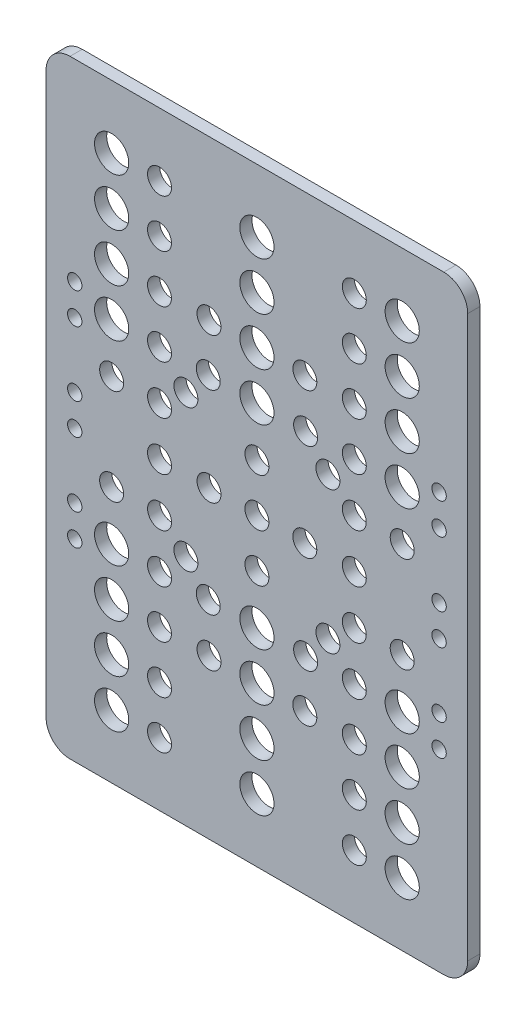
from build123d import *

# Parameters (mm, degrees)
SKETCH2_R           = 3.5685
SKETCH2_R_2         = 2.500000207
SKETCH2_R_3         = 2.500000038
SKETCH2_R_4         = 2.492850486
SKETCH2_R_5         = 1.499992866
SKETCH2_R_6         = 2.500000001
SKETCH2_R_7         = 2.492850485
BOSS_EXTRUDE1_DEPTH = 2.54


with BuildPart() as part:
    # Sketch2 → Boss-Extrude1 (new body)
    with BuildSketch(Plane.XY):
        with BuildLine():
            Line((-92.273812965, -51.714849286), (-14.273812965, -51.714848152))
            ThreePointArc((-14.273812965, -51.714848152), (-10.738279038, -53.179314194), (-9.273812892, -56.714848078))
            Line((-9.273812892, -56.714848078), (-9.273811154, -173.715325349))
            ThreePointArc((-9.273811154, -173.715325349), (-10.738277196, -177.250859277), (-14.273811081, -178.715325423))
            Line((-14.273811081, -178.715325423), (-92.273811081, -178.715326558))
            ThreePointArc((-92.273811081, -178.715326558), (-95.809345008, -177.250860516), (-97.273811154, -173.715326632))
            Line((-97.273811154, -173.715326632), (-97.273812892, -56.714849361))
            ThreePointArc((-97.273812892, -56.714849361), (-95.80934685, -53.179315433), (-92.273812965, -51.714849286))
        make_face()
        with Locations((-83.593812773, -64.894849171)):
            Circle(SKETCH2_R, mode=Mode.SUBTRACT)
        with Locations((-73.598714259, -64.889947536)):
            Circle(SKETCH2_R_2, mode=Mode.SUBTRACT)
        with Locations((-53.273812773, -64.894848719)):
            Circle(SKETCH2_R, mode=Mode.SUBTRACT)
        with Locations((-32.948911283, -64.88994693)):
            Circle(SKETCH2_R_2, mode=Mode.SUBTRACT)
        with Locations((-22.953812773, -64.894848267)):
            Circle(SKETCH2_R, mode=Mode.SUBTRACT)
        with Locations((-83.593812773, -74.894849171)):
            Circle(SKETCH2_R, mode=Mode.SUBTRACT)
        with Locations((-73.598714077, -74.894848647)):
            Circle(SKETCH2_R_3, mode=Mode.SUBTRACT)
        with Locations((-53.273812773, -74.894848719)):
            Circle(SKETCH2_R, mode=Mode.SUBTRACT)
        with Locations((-32.948911213, -74.89484821)):
            Circle(SKETCH2_R_3, mode=Mode.SUBTRACT)
        with Locations((-22.953812773, -74.894848267)):
            Circle(SKETCH2_R, mode=Mode.SUBTRACT)
        with Locations((-22.953812773, -84.894848267)):
            Circle(SKETCH2_R, mode=Mode.SUBTRACT)
        with Locations((-32.948911064, -84.89484821)):
            Circle(SKETCH2_R_3, mode=Mode.SUBTRACT)
        with Locations((-43.273812429, -84.894848364)):
            Circle(SKETCH2_R_3, mode=Mode.SUBTRACT)
        with Locations((-53.273812773, -84.894848719)):
            Circle(SKETCH2_R, mode=Mode.SUBTRACT)
        with Locations((-83.593812773, -84.894849171)):
            Circle(SKETCH2_R, mode=Mode.SUBTRACT)
        with Locations((-73.611151054, -84.902029225)):
            Circle(SKETCH2_R_4, mode=Mode.SUBTRACT)
        with Locations((-63.273812446, -84.894849)):
            Circle(SKETCH2_R_3, mode=Mode.SUBTRACT)
        with Locations((-83.593812773, -94.894849171)):
            Circle(SKETCH2_R, mode=Mode.SUBTRACT)
        with Locations((-73.598713779, -94.894848647)):
            Circle(SKETCH2_R_3, mode=Mode.SUBTRACT)
        with Locations((-63.433812595, -94.89485049)):
            Circle(SKETCH2_R_3, mode=Mode.SUBTRACT)
        with Locations((-53.273812773, -94.894848719)):
            Circle(SKETCH2_R, mode=Mode.SUBTRACT)
        with Locations((-68.09381174, -100.389947487)):
            Circle(SKETCH2_R_2, mode=Mode.SUBTRACT)
        with Locations((-91.293819406, -91.965099732)):
            Circle(SKETCH2_R_5, mode=Mode.SUBTRACT)
        with Locations((-91.293819406, -98.465072086)):
            Circle(SKETCH2_R_5, mode=Mode.SUBTRACT)
        with Locations((-91.293819108, -111.965103757)):
            Circle(SKETCH2_R_5, mode=Mode.SUBTRACT)
        with Locations((-83.593812304, -105.214849125)):
            Circle(SKETCH2_R_3, mode=Mode.SUBTRACT)
        with Locations((-73.593812423, -105.050424838)):
            Circle(SKETCH2_R_3, mode=Mode.SUBTRACT)
        with Locations((-73.598713476, -115.214848518)):
            Circle(SKETCH2_R_3, mode=Mode.SUBTRACT)
        with Locations((-63.273811994, -115.214848871)):
            Circle(SKETCH2_R_3, mode=Mode.SUBTRACT)
        with Locations((-53.273812023, -115.214848719)):
            Circle(SKETCH2_R_6, mode=Mode.SUBTRACT)
        with Locations((-53.273812447, -105.214848674)):
            Circle(SKETCH2_R_3, mode=Mode.SUBTRACT)
        with Locations((-15.253806438, -111.965103757)):
            Circle(SKETCH2_R_5, mode=Mode.SUBTRACT)
        with Locations((-15.25380614, -91.965099732)):
            Circle(SKETCH2_R_5, mode=Mode.SUBTRACT)
        with Locations((-15.25380614, -98.465072086)):
            Circle(SKETCH2_R_5, mode=Mode.SUBTRACT)
        with Locations((-22.953812773, -94.894849171)):
            Circle(SKETCH2_R, mode=Mode.SUBTRACT)
        with Locations((-22.953813242, -105.214849125)):
            Circle(SKETCH2_R_3, mode=Mode.SUBTRACT)
        with Locations((-32.948911767, -94.894848647)):
            Circle(SKETCH2_R_3, mode=Mode.SUBTRACT)
        with Locations((-32.953813123, -105.050424838)):
            Circle(SKETCH2_R_3, mode=Mode.SUBTRACT)
        with Locations((-38.453813806, -100.389947487)):
            Circle(SKETCH2_R_2, mode=Mode.SUBTRACT)
        with Locations((-43.113812951, -94.89485049)):
            Circle(SKETCH2_R_3, mode=Mode.SUBTRACT)
        with Locations((-43.273811978, -115.214848235)):
            Circle(SKETCH2_R_3, mode=Mode.SUBTRACT)
        with Locations((-32.948910612, -115.214848081)):
            Circle(SKETCH2_R_3, mode=Mode.SUBTRACT)
        with Locations((-15.25380614, -138.464597304)):
            Circle(SKETCH2_R_5, mode=Mode.SUBTRACT)
        with Locations((-15.25380614, -131.96462495)):
            Circle(SKETCH2_R_5, mode=Mode.SUBTRACT)
        with Locations((-15.253806438, -118.464593279)):
            Circle(SKETCH2_R_5, mode=Mode.SUBTRACT)
        with Locations((-22.953813242, -125.214847911)):
            Circle(SKETCH2_R_3, mode=Mode.SUBTRACT)
        with Locations((-22.953812773, -135.534847865)):
            Circle(SKETCH2_R, mode=Mode.SUBTRACT)
        with Locations((-22.953812773, -145.534848769)):
            Circle(SKETCH2_R, mode=Mode.SUBTRACT)
        with Locations((-22.953812773, -155.534848769)):
            Circle(SKETCH2_R, mode=Mode.SUBTRACT)
        with Locations((-22.953812773, -165.534848769)):
            Circle(SKETCH2_R, mode=Mode.SUBTRACT)
        with Locations((-32.948911283, -165.539750106)):
            Circle(SKETCH2_R_2, mode=Mode.SUBTRACT)
        with Locations((-32.948911213, -155.534848826)):
            Circle(SKETCH2_R_3, mode=Mode.SUBTRACT)
        with Locations((-32.948911064, -145.534848826)):
            Circle(SKETCH2_R_3, mode=Mode.SUBTRACT)
        with Locations((-32.948911767, -135.534848389)):
            Circle(SKETCH2_R_3, mode=Mode.SUBTRACT)
        with Locations((-38.453813806, -130.039749549)):
            Circle(SKETCH2_R_2, mode=Mode.SUBTRACT)
        with Locations((-32.953813123, -125.379272198)):
            Circle(SKETCH2_R_3, mode=Mode.SUBTRACT)
        with Locations((-43.113812951, -135.534846546)):
            Circle(SKETCH2_R_3, mode=Mode.SUBTRACT)
        with Locations((-43.273812429, -145.534848672)):
            Circle(SKETCH2_R_3, mode=Mode.SUBTRACT)
        with Locations((-53.273812773, -165.534848317)):
            Circle(SKETCH2_R, mode=Mode.SUBTRACT)
        with Locations((-53.273812773, -155.534848317)):
            Circle(SKETCH2_R, mode=Mode.SUBTRACT)
        with Locations((-53.273812773, -145.534848317)):
            Circle(SKETCH2_R, mode=Mode.SUBTRACT)
        with Locations((-53.273812773, -135.534848317)):
            Circle(SKETCH2_R, mode=Mode.SUBTRACT)
        with Locations((-53.273812447, -125.214848362)):
            Circle(SKETCH2_R_3, mode=Mode.SUBTRACT)
        with Locations((-63.273812446, -145.534848036)):
            Circle(SKETCH2_R_3, mode=Mode.SUBTRACT)
        with Locations((-63.433812595, -135.534846546)):
            Circle(SKETCH2_R_3, mode=Mode.SUBTRACT)
        with Locations((-68.09381174, -130.039749549)):
            Circle(SKETCH2_R_2, mode=Mode.SUBTRACT)
        with Locations((-73.593812423, -125.379272198)):
            Circle(SKETCH2_R_3, mode=Mode.SUBTRACT)
        with Locations((-73.598713779, -135.534848389)):
            Circle(SKETCH2_R_3, mode=Mode.SUBTRACT)
        with Locations((-73.611151054, -145.527667811)):
            Circle(SKETCH2_R_7, mode=Mode.SUBTRACT)
        with Locations((-73.598714077, -155.534848389)):
            Circle(SKETCH2_R_3, mode=Mode.SUBTRACT)
        with Locations((-73.598714259, -165.5397495)):
            Circle(SKETCH2_R_2, mode=Mode.SUBTRACT)
        with Locations((-91.293819406, -138.464597304)):
            Circle(SKETCH2_R_5, mode=Mode.SUBTRACT)
        with Locations((-91.293819406, -131.96462495)):
            Circle(SKETCH2_R_5, mode=Mode.SUBTRACT)
        with Locations((-91.293819108, -118.464593279)):
            Circle(SKETCH2_R_5, mode=Mode.SUBTRACT)
        with Locations((-83.593812304, -125.214847911)):
            Circle(SKETCH2_R_3, mode=Mode.SUBTRACT)
        with Locations((-83.593812773, -135.534847865)):
            Circle(SKETCH2_R, mode=Mode.SUBTRACT)
        with Locations((-83.593812773, -145.534847865)):
            Circle(SKETCH2_R, mode=Mode.SUBTRACT)
        with Locations((-83.593812773, -155.534847865)):
            Circle(SKETCH2_R, mode=Mode.SUBTRACT)
        with Locations((-83.593812773, -165.534847865)):
            Circle(SKETCH2_R, mode=Mode.SUBTRACT)
    extrude(amount=BOSS_EXTRUDE1_DEPTH)


solid = part.part
